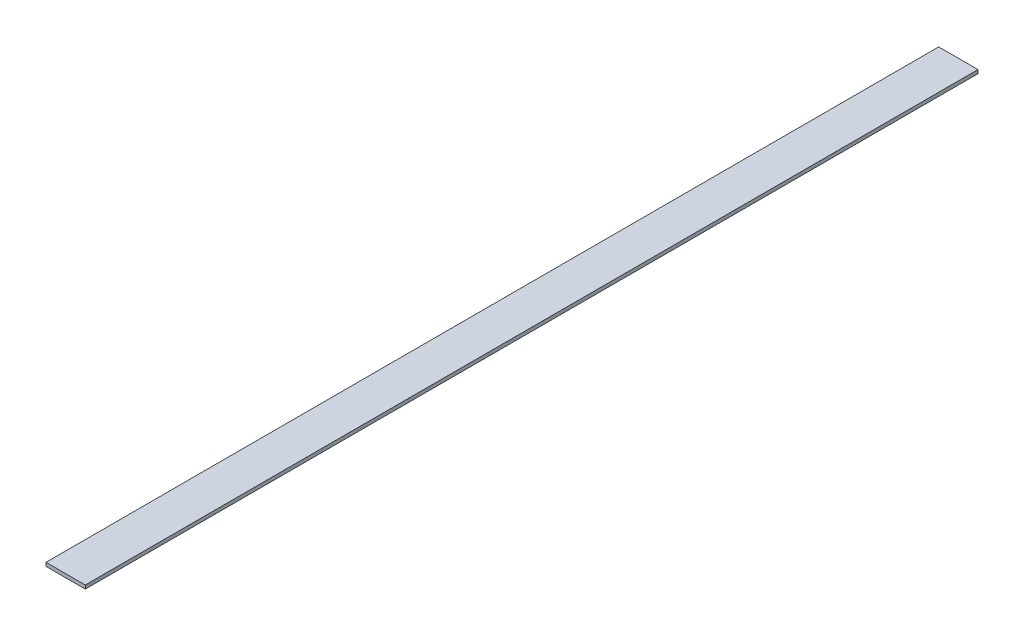
from build123d import *

# Parameters (mm, degrees)
SKETCH1_W           = 110
SKETCH1_H           = 10
BOSS_EXTRUDE1_DEPTH = 2500


with BuildPart() as part:
    # Sketch1 → Boss-Extrude1 (new body)
    with BuildSketch(Plane.XY):
        with Locations((55, -5)):
            Rectangle(SKETCH1_W, SKETCH1_H)
    extrude(amount=BOSS_EXTRUDE1_DEPTH)


solid = part.part
